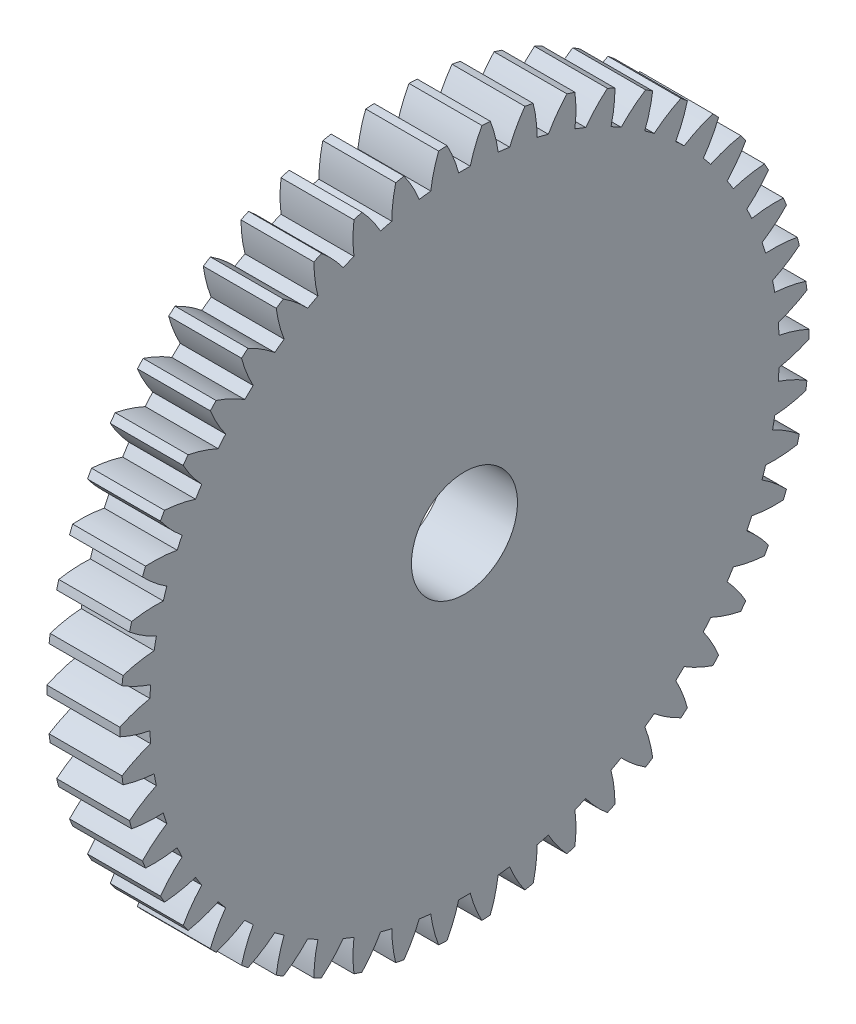
from build123d import *

# Parameters (mm, degrees)
BASPROSKE_W     = 5.5
BASPROSKE_H     = 26
TOOTHCUT_DEPTH  = 38.17862289
TEETHCUTS_COUNT = 50
TEETHCUTS_ANGLE = 352.8
BORSKE_R        = 4
BORE_DEPTH      = 50.0000508


with BuildPart() as part:
    # BasProSke → Base-Revolve (revolve)
    with BuildSketch(Plane(origin=(0, 0, 0), x_dir=(1, 0, 0), z_dir=(0, 1, 0)), mode=Mode.PRIVATE) as base_revolve_sk:
        with Locations((2.75, 13)):
            Rectangle(BASPROSKE_W, BASPROSKE_H)
    revolve(base_revolve_sk.sketch.rotate(Axis((-10, 0, 0), (1, 0, 0)), 180), axis=Axis((-10, 0, 0), (1, 0, 0)))

    # TooCutSke → ToothCut (cut, through all)
    with BuildSketch(Plane(origin=(0, 0, 0), x_dir=(0, 0, -1), z_dir=(1, 0, 0))):
        with BuildLine():
            ThreePointArc((0.437663408, 23.744966872), (0, 23.749), (-0.437663408, 23.744966872))
            ThreePointArc((-0.437663408, 23.744966872), (-0.815428123, 24.895236298), (-1.329433358, 25.991422664))
            ThreePointArc((-1.329433358, 25.991422664), (0, 26.0254), (1.329433358, 25.991422664))
            ThreePointArc((1.329433358, 25.991422664), (0.815428123, 24.895236298), (0.437663408, 23.744966872))
        make_face()
    toothcut = extrude(amount=TOOTHCUT_DEPTH, mode=Mode.SUBTRACT)

    # TeethCuts: ToothCut ×50 about axis
    teethcuts_axis = Axis((-10, 0, 0), (1, 0, 0))
    for i in range(1, TEETHCUTS_COUNT):
        add(toothcut.rotate(teethcuts_axis, i * TEETHCUTS_ANGLE / (TEETHCUTS_COUNT - 1)), mode=Mode.SUBTRACT)

    # BorSke → Bore (cut, symmetric)
    with BuildSketch(Plane(origin=(0, 0, 0), x_dir=(0, 0, -1), z_dir=(1, 0, 0))):
        with Locations(Location((0, 0, 0), (0, 0, 180))):
            Circle(BORSKE_R)
    extrude(amount=BORE_DEPTH, both=True, mode=Mode.SUBTRACT)


solid = part.part
